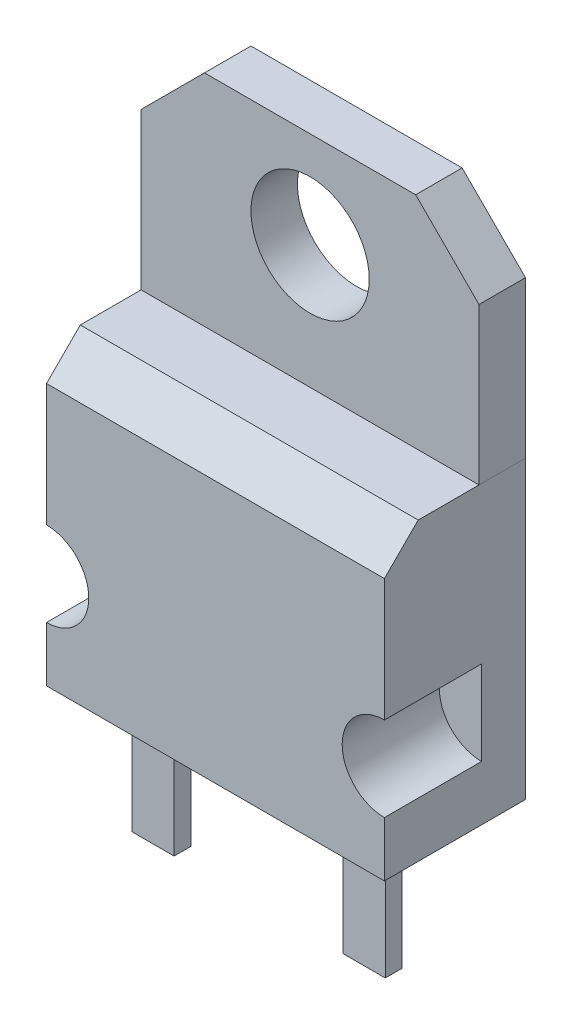
from build123d import *

# Parameters (mm, degrees)
SKETCH2_W             = 10.16
SKETCH2_H             = 6.604
SKETCH2_W_2           = 7.62
SKETCH2_H_2           = 5.842
BOSS_EXTRUDE1_DEPTH   = 1.397
SKETCH3_R             = 1.778
CUT_EXTRUDE1_DEPTH    = 11.553233865
SKETCH4_W             = 10.16
SKETCH4_H             = 8.89
BOSS_EXTRUDE2_DEPTH   = 4.2418
SKETCH7_W             = 7.62
SKETCH7_H             = 5.842
CUT_EXTRUDE3_DEPTH    = 1.397
SKETCH8_W             = 1.27
SKETCH8_H             = 0.508
BOSS_EXTRUDE3_DEPTH   = 3.81
BOSS_EXTRUDE3_2_DEPTH = 3.81
CHAMFER1_SIZE         = 1.905
CHAMFER2_SIZE         = 1.016
SKETCH10_R            = 1.27
CUT_EXTRUDE4_DEPTH    = 2.921


with BuildPart() as part:
    # Sketch2 → Boss-Extrude1 (new body)
    with BuildSketch(Plane.XY):
        Rectangle(SKETCH2_W, SKETCH2_H)
        with Locations((0, -6.223)):
            Rectangle(SKETCH2_W_2, SKETCH2_H_2)
    extrude(amount=BOSS_EXTRUDE1_DEPTH)

    # Sketch3 → Cut-Extrude1 (cut, through all)
    with BuildSketch(Plane.XY.offset(1.397)):
        with Locations((0, 0.4064)):
            Circle(SKETCH3_R)
    extrude(amount=-CUT_EXTRUDE1_DEPTH, mode=Mode.SUBTRACT)

    # Chamfer1
    chamfer1_edges = [part.edges().sort_by_distance(p)[0] for p in [
        (-5.08, 3.302, 0.6985),
        (5.08, 3.302, 0.6985),
    ]]
    chamfer(chamfer1_edges, length=CHAMFER1_SIZE)


with BuildPart() as body_2:
    # Sketch4 → Boss-Extrude2 (new body)
    with BuildSketch(Plane.XY):
        with Locations((0, -7.747)):
            Rectangle(SKETCH4_W, SKETCH4_H)
    extrude(amount=BOSS_EXTRUDE2_DEPTH)

    # Sketch7 → Cut-Extrude3 (cut)
    with BuildSketch(Plane(origin=(0, 0, 0), x_dir=(-1, 0, 0), z_dir=(0, 0, -1))):
        with Locations((0, -6.223)):
            Rectangle(SKETCH7_W, SKETCH7_H)
    extrude(amount=-CUT_EXTRUDE3_DEPTH, mode=Mode.SUBTRACT)

    # Chamfer2
    chamfer2_edges = [body_2.edges().sort_by_distance(p)[0] for p in [
        (0, -3.302, 4.2418),
    ]]
    chamfer(chamfer2_edges, length=CHAMFER2_SIZE)

    # Sketch10 → Cut-Extrude4 (cut)
    with BuildSketch(Plane.XY.offset(4.2418)):
        with Locations((5.08, -9.271)):
            Circle(SKETCH10_R)
        with Locations((-5.08, -9.271)):
            Circle(SKETCH10_R)
    extrude(amount=-CUT_EXTRUDE4_DEPTH, mode=Mode.SUBTRACT)


with BuildPart() as body_3:
    # Sketch8 → Boss-Extrude3 (new body)
    with BuildSketch(Plane.XZ.offset(12.192)):
        with Locations((-3.175, 2.6924)):
            Rectangle(SKETCH8_W, SKETCH8_H)
    extrude(amount=BOSS_EXTRUDE3_DEPTH)


with BuildPart() as body_4:
    # Sketch8 → Boss-Extrude3 2 (new body)
    with BuildSketch(Plane.XZ.offset(12.192)):
        with Locations((3.175, 2.6924)):
            Rectangle(SKETCH8_W, SKETCH8_H)
    extrude(amount=BOSS_EXTRUDE3_2_DEPTH)


solid = Compound([part.part, body_2.part, body_3.part, body_4.part])
